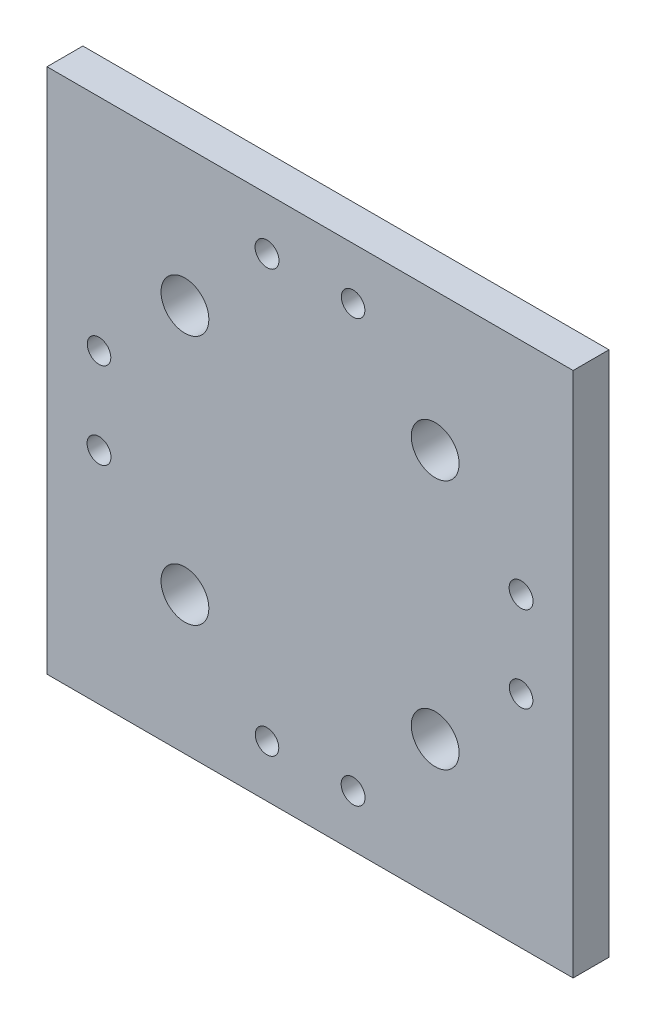
from build123d import *

# Parameters (mm, degrees)
SKETCH1_W                  = 139.7
SKETCH1_H                  = 139.7
EXTRUDE1_DEPTH             = 9.525
F_1_2_0_5_DIAMETER_HOLE1_D = 12.7
CIRPATTERN1_COUNT          = 4


with BuildPart() as part:
    # Sketch1 → Extrude1 (new body)
    with BuildSketch(Plane.XY):
        Rectangle(SKETCH1_W, SKETCH1_H)
    extrude(amount=EXTRUDE1_DEPTH)

    # 1/2 (0.5) Diameter Hole1 (through all)
    with Locations(Plane(origin=(-33.226947648, 33.226947648, 9.525), x_dir=(1, 0, 0), z_dir=(0, 0, 1))):
        with Locations((0, 0)):
            f_1_2_0_5_diameter_hole1 = Hole(F_1_2_0_5_DIAMETER_HOLE1_D / 2)

    # Sketch4 → D (0.246) Diameter Hole1 (revolve, cut)
    with BuildSketch(Plane(origin=(-56.0324, 11.43, 9.525), x_dir=(0, -1, 0), z_dir=(1, 0, 0))):
        Polygon((0, 0), (0, 35.659208746), (3.1242, 33.782), (3.1242, 0), align=None)
    d_0_246_diameter_hole1 = revolve(axis=Axis((-56.0324, 11.43, 15.875), (0, 0, -1)), mode=Mode.SUBTRACT)

    # Sketch5 → 1/4 (0.25) Diameter Hole1 (revolve, cut)
    with BuildSketch(Plane(origin=(-56.0324, -11.43, 9.525), x_dir=(0, -1, 0), z_dir=(1, 0, 0))):
        Polygon((0, 0), (0, 35.689732465), (3.175, 33.782), (3.175, 0), align=None)
    f_1_4_0_25_diameter_hole1 = revolve(axis=Axis((-56.0324, -11.43, 15.875), (0, 0, -1)), mode=Mode.SUBTRACT)

    # CirPattern1: 1/2 (0.5) Diameter Hole1, D (0.246) Diameter Hole1, 1/4 (0.25) Diameter Hole1 ×4 about axis
    cirpattern1_axis = Axis((0, 0, 0), (0, 0, 1))
    add([f_1_2_0_5_diameter_hole1.rotate(cirpattern1_axis, i * 360 / CIRPATTERN1_COUNT) for i in range(1, CIRPATTERN1_COUNT)], mode=Mode.SUBTRACT)
    add([d_0_246_diameter_hole1.rotate(cirpattern1_axis, i * 360 / CIRPATTERN1_COUNT) for i in range(1, CIRPATTERN1_COUNT)], mode=Mode.SUBTRACT)
    add([f_1_4_0_25_diameter_hole1.rotate(cirpattern1_axis, i * 360 / CIRPATTERN1_COUNT) for i in range(1, CIRPATTERN1_COUNT)], mode=Mode.SUBTRACT)


solid = part.part
